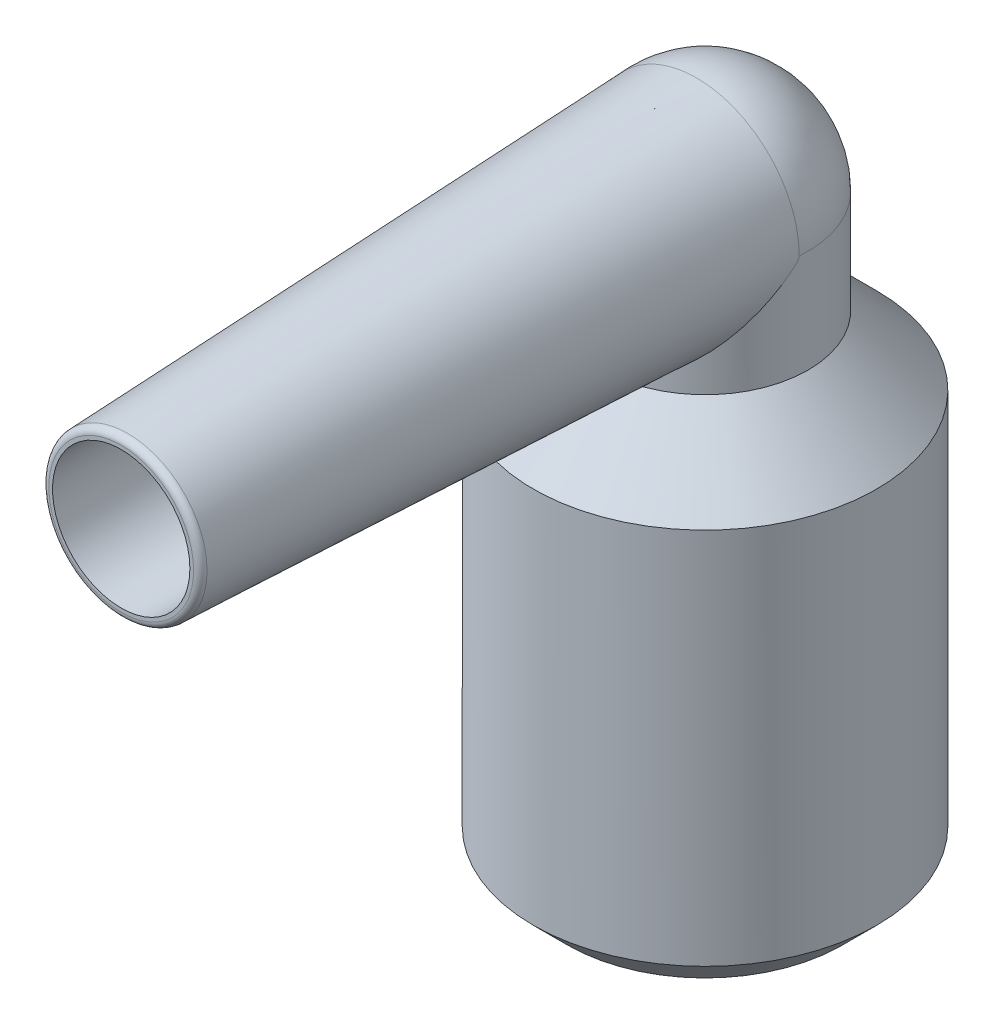
from build123d import *

# Parameters (mm, degrees)
SKETCH_1_R          = 2.5
EXTRUDE_1_DEPTH     = 6
SKETCH_2_R          = 2.5
SKETCH_3_R          = 1.5
SKETCH_5_R          = 1.5
SKETCH_6_R          = 1.15
SKETCH_7_R          = 1
CUT_EXTRUDE_1_DEPTH = 8.5
SKETCH_8_R          = 1.25
CUT_EXTRUDE_2_DEPTH = 8.5
CHAMFER_1_SIZE      = 0.5
FILLET_1_R          = 0.1


with BuildPart() as part:
    # 草图1 → 凸台-拉伸1 (new body)
    with BuildSketch(Plane(origin=(0, 0, 0), x_dir=(1, 0, 0), z_dir=(0, 1, 0))):
        with Locations(Location((0, 0, 0), (0, 0, 270))):
            Circle(SKETCH_1_R)
    extrude(amount=EXTRUDE_1_DEPTH)

    # 草图2 → 放样1 section 0
    with BuildSketch(Plane(origin=(0, 6, 0), x_dir=(1, 0, 0), z_dir=(0, 1, 0))):
        Circle(SKETCH_2_R)
    # 草图3 → 放样1 section 1
    with BuildSketch(Plane(origin=(0, 7, 0), x_dir=(1, 0, 0), z_dir=(0, 1, 0))):
        Circle(SKETCH_3_R)
    loft()

    # 草图4 → 旋转1 (revolve)
    with BuildSketch(Plane.XY, mode=Mode.PRIVATE) as revolve_1_sk:
        with BuildLine():
            Line((0, 7), (0, 8.5))
            Line((0, 8.5), (0, 10))
            ThreePointArc((0, 10), (-1.060660172, 9.560660172), (-1.5, 8.5))
            Line((-1.5, 8.5), (-1.5, 7))
            Line((-1.5, 7), (0, 7))
        make_face()
    revolve(revolve_1_sk.sketch.rotate(Axis((0, 8.5, 0), (0, 1, 0)), 270), axis=Axis((0, 8.5, 0), (0, 1, 0)))

    # 草图5 → 放样2 section 0
    with BuildSketch(Plane.XY):
        with Locations((0, 8.5)):
            Circle(SKETCH_5_R)
    # 草图6 → 放样2 section 1
    with BuildSketch(Plane.XY.offset(8.5)):
        with Locations((0, 8.5)):
            Circle(SKETCH_6_R)
    loft()

    # 草图7 → 切除-拉伸1 (cut)
    with BuildSketch(Plane.XY.offset(8.5)):
        with Locations((0, 8.5)):
            Circle(SKETCH_7_R)
    extrude(amount=-CUT_EXTRUDE_1_DEPTH, mode=Mode.SUBTRACT)

    # 草图8 → 切除-拉伸2 (cut)
    with BuildSketch(Plane.XZ):
        with Locations(Location((0, 0, 0), (0, 0, 270))):
            Circle(SKETCH_8_R)
    extrude(amount=-CUT_EXTRUDE_2_DEPTH, mode=Mode.SUBTRACT)

    # 倒角1
    chamfer_1_edges = [part.edges().sort_by_distance(p)[0] for p in [
        (0, 0, -2.5),
        (0, 0, 1.25),
    ]]
    chamfer(chamfer_1_edges, length=CHAMFER_1_SIZE)

    # 圆角1
    fillet_1_edges = [part.edges().sort_by_distance(p)[0] for p in [
        (-1.15, 8.5, 8.5),
    ]]
    fillet(fillet_1_edges, radius=FILLET_1_R)


solid = part.part
